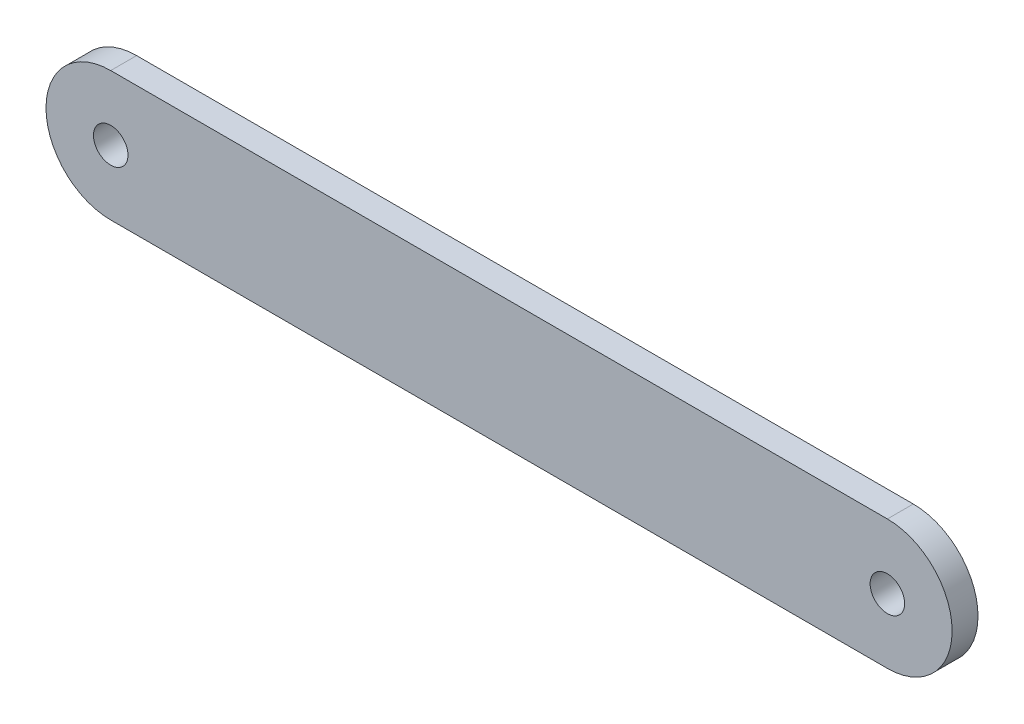
from build123d import *

# Parameters (mm, degrees)
SKETCH1_R           = 2
BOSS_EXTRUDE1_DEPTH = 3


with BuildPart() as part:
    # Sketch1 → Boss-Extrude1 (new body)
    with BuildSketch(Plane.XY):
        with BuildLine():
            Line((0, 7.5), (90, 7.5))
            ThreePointArc((90, 7.5), (97.5, 0), (90, -7.5))
            Line((90, -7.5), (0, -7.5))
            ThreePointArc((0, -7.5), (-7.5, 0), (0, 7.5))
        make_face()
        Circle(SKETCH1_R, mode=Mode.SUBTRACT)
        with Locations((90, 0)):
            Circle(SKETCH1_R, mode=Mode.SUBTRACT)
    extrude(amount=BOSS_EXTRUDE1_DEPTH)


solid = part.part
